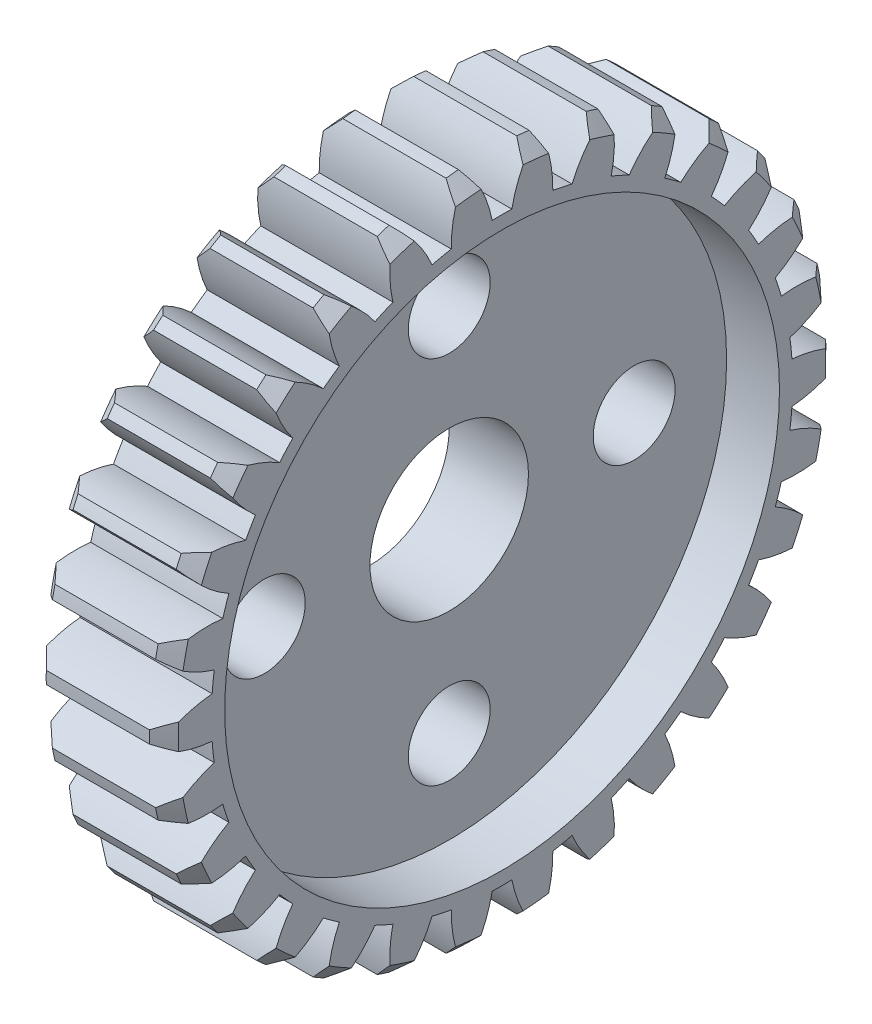
from build123d import *

# Parameters (mm, degrees)
BASPROSKE_W         = 5
BASPROSKE_H         = 12.8
TOOTHCUT_DEPTH      = 19.779776356
TEETHCUTS_COUNT     = 30
TEETHCUTS_ANGLE     = 348
BORSKE_R            = 3
BORE_DEPTH          = 50.0000508
SKETCH_1_R          = 10.5
CUT_EXTRUDE_1_DEPTH = 2
SKETCH_2_R          = 1.55
CUT_EXTRUDE_2_DEPTH = 5


with BuildPart() as part:
    # BasProSke → Base-Revolve (revolve)
    with BuildSketch(Plane(origin=(0, 0, 0), x_dir=(1, 0, 0), z_dir=(0, 1, 0)), mode=Mode.PRIVATE) as base_revolve_sk:
        with Locations((2.5, 6.4)):
            Rectangle(BASPROSKE_W, BASPROSKE_H)
    revolve(base_revolve_sk.sketch.rotate(Axis((-10, 0, 0), (1, 0, 0)), 180), axis=Axis((-10, 0, 0), (1, 0, 0)))

    # TooCutSke → ToothCut (cut, through all)
    with BuildSketch(Plane(origin=(0, 0, 0), x_dir=(0, 0, -1), z_dir=(1, 0, 0))):
        with BuildLine():
            ThreePointArc((0.37243947, 10.992692566), (0, 10.999), (-0.37243947, 10.992692566))
            ThreePointArc((-0.37243947, 10.992692566), (-0.655704499, 11.922595954), (-1.120515575, 12.776358245))
            ThreePointArc((-1.120515575, 12.776358245), (0, 12.8254), (1.120515575, 12.776358245))
            ThreePointArc((1.120515575, 12.776358245), (0.655704499, 11.922595954), (0.37243947, 10.992692566))
        make_face()
    toothcut = extrude(amount=TOOTHCUT_DEPTH, mode=Mode.SUBTRACT)

    # TeethCuts: ToothCut ×30 about axis
    teethcuts_axis = Axis((-10, 0, 0), (1, 0, 0))
    for i in range(1, TEETHCUTS_COUNT):
        add(toothcut.rotate(teethcuts_axis, i * TEETHCUTS_ANGLE / (TEETHCUTS_COUNT - 1)), mode=Mode.SUBTRACT)

    # BorSke → Bore (cut, symmetric)
    with BuildSketch(Plane(origin=(0, 0, 0), x_dir=(0, 0, -1), z_dir=(1, 0, 0))):
        with Locations(Location((0, 0, 0), (0, 0, 180))):
            Circle(BORSKE_R)
    extrude(amount=BORE_DEPTH, both=True, mode=Mode.SUBTRACT)

    # 草图1 → 切除-拉伸1 (cut)
    with BuildSketch(Plane(origin=(5, 0, 0), x_dir=(0, 0, -1), z_dir=(1, 0, 0))):
        Circle(SKETCH_1_R)
    extrude(amount=-CUT_EXTRUDE_1_DEPTH, mode=Mode.SUBTRACT)

    # 草图2 → 切除-拉伸2 (cut)
    with BuildSketch(Plane(origin=(3, 0, 0), x_dir=(0, 0, -1), z_dir=(1, 0, 0))):
        with Locations((0, 7)):
            Circle(SKETCH_2_R)
        with Locations((7, 0)):
            Circle(SKETCH_2_R)
        with Locations((0, -7)):
            Circle(SKETCH_2_R)
        with Locations((-7, 0)):
            Circle(SKETCH_2_R)
    extrude(amount=-CUT_EXTRUDE_2_DEPTH, mode=Mode.SUBTRACT)

    # 切除-扫描1: sweep along a path in 草图4
    with BuildLine(Plane.ZY) as sweep_1_path:
        CenterArc((0, 0), 12.252287675, 0, 360)
    # 草图3 → 切除-扫描1 (sweep, cut)
    with BuildSketch(Plane.XY):
        Polygon((0, 15.348335008), (0, 12.252287675), (3.096047333, 15.348335008), align=None)
    sweep_1 = sweep(path=sweep_1_path.line, mode=Mode.SUBTRACT)

    # 镜向1: 切除-扫描1 across plane
    add(sweep_1.mirror(Plane.ZY.offset(-2.5)), mode=Mode.SUBTRACT)


solid = part.part
